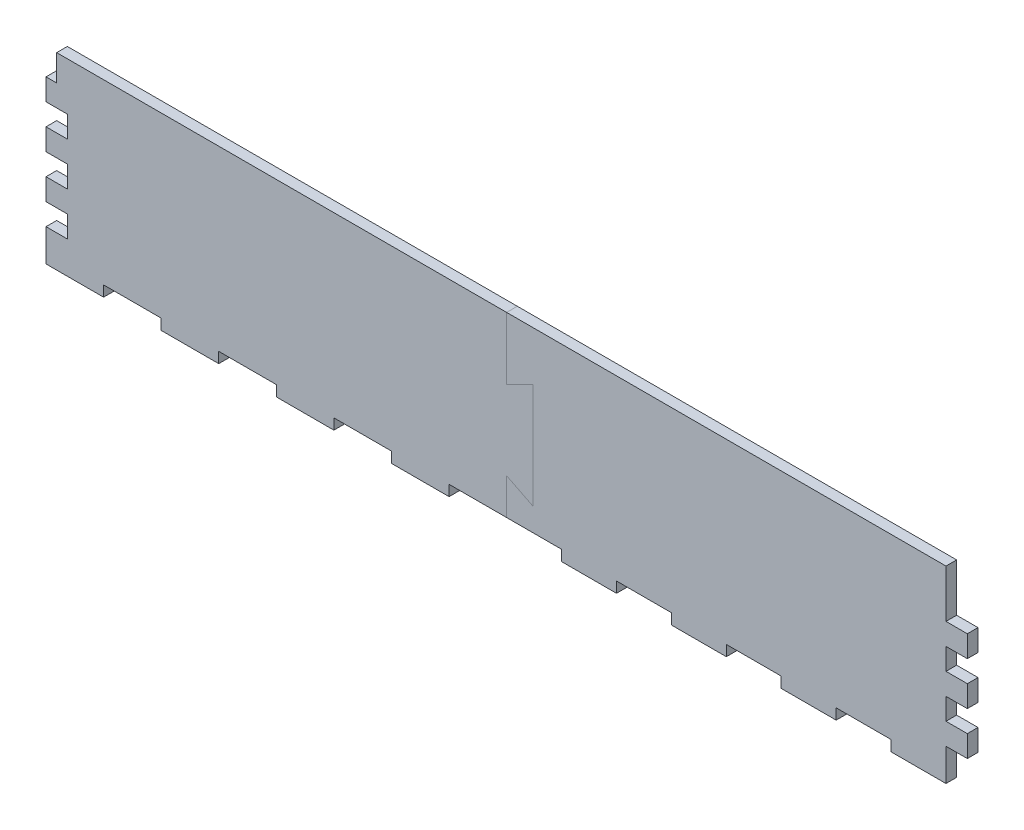
from build123d import *

# Parameters (mm, degrees)
SKETCH1_W              = 444.5
SKETCH1_H              = 73.025
BOSS_EXTRUDE1_DEPTH    = 5.15
SKETCH3_W              = 3.175
SKETCH3_H              = 73.025
BOSS_EXTRUDE2_DEPTH    = 441.325
SKETCH4_W              = 3.175
SKETCH4_H              = 73.025
BOSS_EXTRUDE3_DEPTH    = 438.15
SPLIT2_SURFACE_1_BACK  = 635.234
SPLIT2_SURFACE_1_DEPTH = 1270.468
SPLIT2_SURFACE_2_BACK  = 635.234
SPLIT2_SURFACE_2_DEPTH = 1270.468
SKETCH8_W              = 441.325
SKETCH8_H              = 73.025
CUT_EXTRUDE2_DEPTH     = 631.619264097
SKETCH9_W              = 10.300000228
SKETCH9_H              = 10.432142857
SKETCH9_H_2            = 10.432142858
CUT_EXTRUDE3_DEPTH     = 451.48798333
SKETCH15_W             = 26.493749972
SKETCH15_H             = 5.15
BOSS_EXTRUDE6_DEPTH    = 5.15
SKETCH16_W             = 27.78125
SKETCH16_H             = 5.15
BOSS_EXTRUDE7_DEPTH    = 5.15
SKETCH17_W             = 211.949999772
SKETCH17_H             = 12.7
BOSS_EXTRUDE8_DEPTH    = 5.15
SKETCH18_W             = 217.099999886
SKETCH18_H             = 12.7
BOSS_EXTRUDE9_DEPTH    = 5.15


with BuildPart() as part:
    # Sketch1 → Boss-Extrude1 (new body)
    with BuildSketch(Plane.XY):
        with Locations((222.25, 36.5125)):
            Rectangle(SKETCH1_W, SKETCH1_H)
    extrude(amount=BOSS_EXTRUDE1_DEPTH)

    # Sketch3 → Boss-Extrude2 (add)
    with BuildSketch(Plane(origin=(0, 0, 0), x_dir=(-1, 0, 0), z_dir=(0, 0, -1))):
        with Locations((-442.9125, 36.5125)):
            Rectangle(SKETCH3_W, SKETCH3_H)
        with Locations((-1.5875, 36.5125)):
            Rectangle(SKETCH3_W, SKETCH3_H)
    extrude(amount=BOSS_EXTRUDE2_DEPTH)

    # Sketch4 → Boss-Extrude3 (add)
    with BuildSketch(Plane(origin=(3.175, 0, 0), x_dir=(0, 0, -1), z_dir=(1, 0, 0))):
        with Locations((439.7375, 36.5125)):
            Rectangle(SKETCH4_W, SKETCH4_H)
    extrude(amount=BOSS_EXTRUDE3_DEPTH)


with BuildPart() as body_2:
    # Split2: the piece behind the surface
    add(part.part)
    # Split2 surface: a surface, the sketch's curves swept straight by 1270.468 mm
    with BuildLine(Plane(origin=(0, 0, 5.15), x_dir=(-1, 0, 0), z_dir=(0, 0, -1)).offset(-SPLIT2_SURFACE_1_BACK), mode=Mode.PRIVATE) as split2_surface_1_path:
        Line((-222.25, 73.025), (-222.25, 55.5625))
        Line((-222.25, 55.5625), (-234.95, 61.9125))
        Line((-234.95, 61.9125), (-234.95, 11.1125))
        Line((-234.95, 11.1125), (-222.25, 17.4625))
        Line((-222.25, 17.4625), (-222.25, 0))
    split2_surface_1 = Shell.extrude(split2_surface_1_path.wire(), (0 * SPLIT2_SURFACE_1_DEPTH, 0 * SPLIT2_SURFACE_1_DEPTH, -1 * SPLIT2_SURFACE_1_DEPTH))
    split(bisect_by=split2_surface_1, keep=Keep.BOTTOM)


with BuildPart() as part_1:
    add(part.part)

    # Split2: split by a surface, the side it looks to stays
    # Split2 surface: a surface, the sketch's curves swept straight by 1270.468 mm
    with BuildLine(Plane(origin=(0, 0, 5.15), x_dir=(-1, 0, 0), z_dir=(0, 0, -1)).offset(-SPLIT2_SURFACE_2_BACK), mode=Mode.PRIVATE) as split2_surface_2_path:
        Line((-222.25, 73.025), (-222.25, 55.5625))
        Line((-222.25, 55.5625), (-234.95, 61.9125))
        Line((-234.95, 61.9125), (-234.95, 11.1125))
        Line((-234.95, 11.1125), (-222.25, 17.4625))
        Line((-222.25, 17.4625), (-222.25, 0))
    split2_surface_2 = Shell.extrude(split2_surface_2_path.wire(), (0 * SPLIT2_SURFACE_2_DEPTH, 0 * SPLIT2_SURFACE_2_DEPTH, -1 * SPLIT2_SURFACE_2_DEPTH))
    split(bisect_by=split2_surface_2, keep=Keep.TOP)


with BuildPart() as cut_extrude2_tool:
    # Sketch8 → Cut-Extrude2 (new, through all)
    with BuildSketch(Plane(origin=(444.5, 0, 0), x_dir=(0, 0, -1), z_dir=(1, 0, 0))):
        with Locations((220.6625, 36.5125)):
            Rectangle(SKETCH8_W, SKETCH8_H)
    extrude(amount=-CUT_EXTRUDE2_DEPTH)


with BuildPart() as part_2:
    add(part_1.part)

    # Cut-Extrude2: cut by cut_extrude2_tool
    add(cut_extrude2_tool.part, mode=Mode.SUBTRACT)


with BuildPart() as body_2_1:
    add(body_2.part)

    # Cut-Extrude2: cut by cut_extrude2_tool
    add(cut_extrude2_tool.part, mode=Mode.SUBTRACT)


with BuildPart() as cut_extrude3_tool:
    # Sketch9 → Cut-Extrude3 (new, through all)
    with BuildSketch(Plane(origin=(0, 0, 0), x_dir=(-1, 0, 0), z_dir=(0, 0, -1))):
        with Locations((-439.349999886, 67.808928572)):
            Rectangle(SKETCH9_W, SKETCH9_H)
        with Locations((-439.349999886, 46.944642857)):
            Rectangle(SKETCH9_W, SKETCH9_H)
        with Locations((-439.349999886, 26.080357143)):
            Rectangle(SKETCH9_W, SKETCH9_H)
        with Locations((-439.349999886, 5.216071429)):
            Rectangle(SKETCH9_W, SKETCH9_H)
        with Locations((-5.150000114, 57.376785715)):
            Rectangle(SKETCH9_W, SKETCH9_H)
        with Locations((-5.150000114, 36.5125)):
            Rectangle(SKETCH9_W, SKETCH9_H_2)
        with Locations((-5.150000114, 15.648214285)):
            Rectangle(SKETCH9_W, SKETCH9_H)
    extrude(amount=-CUT_EXTRUDE3_DEPTH)


with BuildPart() as part_3:
    add(part_2.part)

    # Cut-Extrude3: cut by cut_extrude3_tool
    add(cut_extrude3_tool.part, mode=Mode.SUBTRACT)

    # Sketch16 → Boss-Extrude7 (add)
    with BuildSketch(Plane(origin=(0, 0, 0), x_dir=(-1, 0, 0), z_dir=(0, 0, -1))):
        with Locations((-13.890625, -2.575)):
            Rectangle(SKETCH16_W, SKETCH16_H)
        with Locations((-69.453125, -2.575)):
            Rectangle(SKETCH16_W, SKETCH16_H)
        with Locations((-125.015625, -2.575)):
            Rectangle(SKETCH16_W, SKETCH16_H)
        with Locations((-180.578125, -2.575)):
            Rectangle(SKETCH16_W, SKETCH16_H)
    extrude(amount=-BOSS_EXTRUDE7_DEPTH)

    # Sketch18 → Boss-Extrude9 (add)
    with BuildSketch(Plane(origin=(0, 0, 0), x_dir=(-1, 0, 0), z_dir=(0, 0, -1))):
        with Locations((-113.700000057, 79.375)):
            Rectangle(SKETCH18_W, SKETCH18_H)
    extrude(amount=-BOSS_EXTRUDE9_DEPTH)


with BuildPart() as body_2_2:
    add(body_2_1.part)

    # Cut-Extrude3: cut by cut_extrude3_tool
    add(cut_extrude3_tool.part, mode=Mode.SUBTRACT)

    # Sketch15 → Boss-Extrude6 (add)
    with BuildSketch(Plane(origin=(0, 0, 0), x_dir=(-1, 0, 0), z_dir=(0, 0, -1))):
        with Locations((-420.953124786, -2.575)):
            Rectangle(SKETCH15_W, SKETCH15_H)
        with Locations((-367.965624843, -2.575)):
            Rectangle(SKETCH15_W, SKETCH15_H)
        with Locations((-314.9781249, -2.575)):
            Rectangle(SKETCH15_W, SKETCH15_H)
        with Locations((-261.990624957, -2.575)):
            Rectangle(SKETCH15_W, SKETCH15_H)
    extrude(amount=-BOSS_EXTRUDE6_DEPTH)

    # Sketch17 → Boss-Extrude8 (add)
    with BuildSketch(Plane(origin=(0, 0, 0), x_dir=(-1, 0, 0), z_dir=(0, 0, -1))):
        with Locations((-328.224999886, 79.375)):
            Rectangle(SKETCH17_W, SKETCH17_H)
    extrude(amount=-BOSS_EXTRUDE8_DEPTH)


solid = Compound([part_3.part, body_2_2.part])
